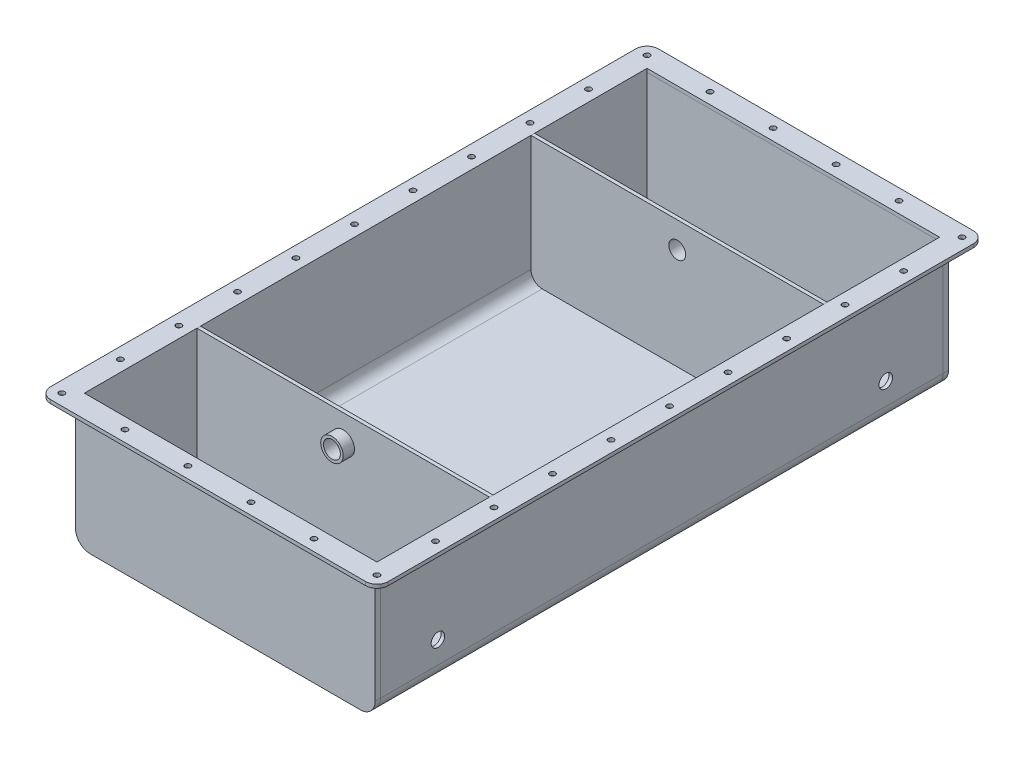
from build123d import *

# Parameters (mm, degrees)
INTERIOR_DIM_DEPTH      = 500
FILLET2_R               = 10
FILLET3_R               = 13.175
ENDCAP1_DEPTH           = 4.7625
COMPARTMENT1_BOSS_DEPTH = 3.175
SKETCH9_W               = 300
SKETCH9_H               = 540
SKETCH9_W_2             = 260
SKETCH9_H_2             = 500
LID_FLANGE_DEPTH        = 3.175
FILLET4_R               = 10
ENDCAP2_DEPTH           = 4.7625
COMPARTMENT2_BOSS_DEPTH = 3.175
SKETCH16_R              = 6
BEARING_HOLES_DEPTH     = 603.823905672
WIRE_PASSTHROUGH_START  = -300
SKETCH17_R              = 7.5
WIRE_PASSTHROUGH_DEPTH  = 300
SKETCH18_W              = 260
SKETCH18_H              = 3.175
BOSS_EXTRUDE1_DEPTH     = 3.18
SKETCH17_3_R            = 10
SKETCH17_3_R_2          = 7.5
WIRE_TUBE_2_DEPTH       = 10
WIRE_TUBE_1_START       = 10
SKETCH19_R              = 10
SKETCH19_R_2            = 7.5
WIRE_TUBE_1_DEPTH       = 10
SKETCH20_R              = 2.5
BOLT_HOLES_DEPTH        = 3.175


with BuildPart() as part:
    # Sketch2 → Interior Dim (new body)
    with BuildSketch(Plane.XY):
        Polygon((-130, 0), (130, 0), (130, 110), (133.175, 110), (133.175, -3.175), (-133.175, -3.175), (-133.175, 110), (-130, 110), align=None)
    extrude(amount=-INTERIOR_DIM_DEPTH)

    # Fillet2
    fillet2_edges = [part.edges().sort_by_distance(p)[0] for p in [
        (-130, 0, -250),
        (130, 0, -250),
    ]]
    fillet(fillet2_edges, radius=FILLET2_R)

    # Fillet3
    fillet3_edges = [part.edges().sort_by_distance(p)[0] for p in [
        (-133.175, -3.175, -250),
        (133.175, -3.175, -250),
    ]]
    fillet(fillet3_edges, radius=FILLET3_R)



with BuildPart() as body_2:
    # Sketch4 → Endcap1 (new body)
    with BuildSketch(Plane.XY):
        with BuildLine():
            Line((-130, 110), (130, 110))
            Line((130, 110), (133.175, 110))
            Line((133.175, 110), (133.175, 10))
            ThreePointArc((133.175, 10), (129.316131842, 0.683868158), (120, -3.175))
            Line((120, -3.175), (-120, -3.175))
            ThreePointArc((-120, -3.175), (-129.316131842, 0.683868158), (-133.175, 10))
            Line((-133.175, 10), (-133.175, 110))
            Line((-133.175, 110), (-130, 110))
        make_face()
    extrude(amount=ENDCAP1_DEPTH)


with BuildPart() as body_3:
    # Sketch7 → Compartment1_Boss (new body)
    with BuildSketch(Plane(origin=(0, 0, -100), x_dir=(-1, 0, 0), z_dir=(0, 0, -1))):
        with BuildLine():
            Line((120, 0), (-120, 0))
            ThreePointArc((-120, 0), (-127.071067812, 2.928932188), (-130, 10))
            Line((-130, 10), (-130, 110))
            Line((-130, 110), (130, 110))
            Line((130, 110), (130, 10))
            ThreePointArc((130, 10), (127.071067812, 2.928932188), (120, 0))
        make_face()
    extrude(amount=COMPARTMENT1_BOSS_DEPTH)


with BuildPart() as body_4:
    # Sketch9 → Lid_Flange (new body)
    with BuildSketch(Plane(origin=(0, 110, 0), x_dir=(1, 0, 0), z_dir=(0, 1, 0))):
        with Locations((0, 250)):
            Rectangle(SKETCH9_W, SKETCH9_H)
        with Locations((0, 250)):
            Rectangle(SKETCH9_W_2, SKETCH9_H_2, mode=Mode.SUBTRACT)
    extrude(amount=LID_FLANGE_DEPTH)

    # Fillet4
    fillet4_edges = [body_4.edges().sort_by_distance(p)[0] for p in [
        (150, 111.5875, -520),
        (150, 111.5875, 20),
        (-150, 111.5875, 20),
        (-150, 111.5875, -520),
    ]]
    fillet(fillet4_edges, radius=FILLET4_R)


with BuildPart() as body_5:
    # Sketch5 → Endcap2 (new body)
    with BuildSketch(Plane(origin=(0, 0, -500), x_dir=(-1, 0, 0), z_dir=(0, 0, -1))):
        with BuildLine():
            Line((133.175, 110), (-133.175, 110))
            Line((-133.175, 110), (-133.175, 10))
            ThreePointArc((-133.175, 10), (-129.316131842, 0.683868158), (-120, -3.175))
            Line((-120, -3.175), (120, -3.175))
            ThreePointArc((120, -3.175), (129.316131842, 0.683868158), (133.175, 10))
            Line((133.175, 10), (133.175, 110))
        make_face()
    extrude(amount=ENDCAP2_DEPTH)


with BuildPart() as part_1:
    add(part.part)

    add(body_4.part)  # Compartment2_Boss merges body 4
    # Sketch13 → Compartment2_Boss (add)
    with BuildSketch(Plane.XY.offset(-400)):
        with BuildLine():
            Line((130, 110), (-130, 110))
            Line((-130, 110), (-130, 10))
            ThreePointArc((-130, 10), (-127.071067812, 2.928932188), (-120, 0))
            Line((-120, 0), (120, 0))
            ThreePointArc((120, 0), (127.071067812, 2.928932188), (130, 10))
            Line((130, 10), (130, 110))
        make_face()
    extrude(amount=COMPARTMENT2_BOSS_DEPTH)

    # Sketch16 → Bearing_holes (cut, through all)
    with BuildSketch(Plane.ZY.offset(133.175)):
        with Locations(Location((-449, 29.5, 0), (0, 0, 270))):
            Circle(SKETCH16_R)
        with Locations(Location((-51, 29.5, 0), (0, 0, 270))):
            Circle(SKETCH16_R)
    extrude(amount=-BEARING_HOLES_DEPTH, mode=Mode.SUBTRACT)


with BuildPart() as wire_passthrough_tool:
    # Sketch17 → Wire_Passthrough (new body)
    with BuildSketch(Plane(origin=(0, 0, -400), x_dir=(-1, 0, 0), z_dir=(0, 0, -1)).offset(WIRE_PASSTHROUGH_START)):
        with Locations((0, 90)):
            Circle(SKETCH17_R)
    extrude(amount=WIRE_PASSTHROUGH_DEPTH)


with BuildPart() as part_2:
    add(part_1.part)

    # Wire_Passthrough: cut by wire_passthrough_tool
    add(wire_passthrough_tool.part, mode=Mode.SUBTRACT)



with BuildPart() as body_3_1:
    add(body_3.part)

    # Wire_Passthrough: cut by wire_passthrough_tool
    add(wire_passthrough_tool.part, mode=Mode.SUBTRACT)


with BuildPart() as part_3:
    add(part_2.part)

    add(body_3_1.part)  # Boss-Extrude1 merges body 3
    # Sketch18 → Boss-Extrude1 (add)
    with BuildSketch(Plane(origin=(0, 110, 0), x_dir=(1, 0, 0), z_dir=(0, 1, 0))):
        with Locations((0, 398.4125)):
            Rectangle(SKETCH18_W, SKETCH18_H)
        with Locations((0, 101.5875)):
            Rectangle(SKETCH18_W, SKETCH18_H)
    extrude(amount=BOSS_EXTRUDE1_DEPTH)

    # Sketch17<3> → Wire_Tube_2 (add)
    with BuildSketch(Plane(origin=(0, 0, -400), x_dir=(-1, 0, 0), z_dir=(0, 0, -1))):
        with Locations((0, 90)):
            Circle(SKETCH17_3_R)
        with Locations((0, 90)):
            Circle(SKETCH17_3_R_2, mode=Mode.SUBTRACT)
    extrude(amount=WIRE_TUBE_2_DEPTH)

    # Sketch19 → Wire_Tube_1 (add)
    with BuildSketch(Plane.XY.offset(-100).offset(WIRE_TUBE_1_START)):
        with Locations(Location((0, 90, 0), (0, 0, 180))):
            Circle(SKETCH19_R)
        with Locations(Location((0, 90, 0), (0, 0, 180))):
            Circle(SKETCH19_R_2, mode=Mode.SUBTRACT)
    extrude(amount=-WIRE_TUBE_1_DEPTH)

    # Sketch20 → Bolt_Holes (cut)
    with BuildSketch(Plane(origin=(0, 110, 175), x_dir=(1, 0, 0), z_dir=(0, 1, 0))):
        with Locations(Location((-140, 165, 0), (0, 0, 270))):
            Circle(SKETCH20_R)
        with Locations(Location((-140, 217, 0), (0, 0, 270))):
            Circle(SKETCH20_R)
        with Locations(Location((-140, 269, 0), (0, 0, 270))):
            Circle(SKETCH20_R)
        with Locations(Location((-140, 321, 0), (0, 0, 270))):
            Circle(SKETCH20_R)
        with Locations(Location((-140, 373, 0), (0, 0, 270))):
            Circle(SKETCH20_R)
        with Locations(Location((-140, 425, 0), (0, 0, 270))):
            Circle(SKETCH20_R)
        with Locations(Location((-140, 477, 0), (0, 0, 270))):
            Circle(SKETCH20_R)
        with Locations(Location((-140, 529, 0), (0, 0, 270))):
            Circle(SKETCH20_R)
        with Locations(Location((-140, 581, 0), (0, 0, 270))):
            Circle(SKETCH20_R)
        with Locations(Location((-140, 633, 0), (0, 0, 270))):
            Circle(SKETCH20_R)
        with Locations(Location((-140, 685, 0), (0, 0, 270))):
            Circle(SKETCH20_R)
        with Locations(Location((-84, 685, 0), (0, 0, 270))):
            Circle(SKETCH20_R)
        with Locations(Location((-28, 685, 0), (0, 0, 270))):
            Circle(SKETCH20_R)
        with Locations(Location((28, 685, 0), (0, 0, 270))):
            Circle(SKETCH20_R)
        with Locations(Location((84, 685, 0), (0, 0, 270))):
            Circle(SKETCH20_R)
        with Locations(Location((140, 685, 0), (0, 0, 270))):
            Circle(SKETCH20_R)
        with Locations(Location((140, 633, 0), (0, 0, 270))):
            Circle(SKETCH20_R)
        with Locations(Location((140, 581, 0), (0, 0, 270))):
            Circle(SKETCH20_R)
        with Locations(Location((140, 529, 0), (0, 0, 270))):
            Circle(SKETCH20_R)
        with Locations(Location((140, 477, 0), (0, 0, 270))):
            Circle(SKETCH20_R)
        with Locations(Location((140, 425, 0), (0, 0, 270))):
            Circle(SKETCH20_R)
        with Locations(Location((140, 373, 0), (0, 0, 270))):
            Circle(SKETCH20_R)
        with Locations(Location((140, 321, 0), (0, 0, 270))):
            Circle(SKETCH20_R)
        with Locations(Location((140, 269, 0), (0, 0, 270))):
            Circle(SKETCH20_R)
        with Locations(Location((140, 217, 0), (0, 0, 270))):
            Circle(SKETCH20_R)
        with Locations(Location((140, 165, 0), (0, 0, 270))):
            Circle(SKETCH20_R)
        with Locations(Location((84, 165, 0), (0, 0, 270))):
            Circle(SKETCH20_R)
        with Locations(Location((28, 165, 0), (0, 0, 270))):
            Circle(SKETCH20_R)
        with Locations(Location((-28, 165, 0), (0, 0, 270))):
            Circle(SKETCH20_R)
        with Locations(Location((-84, 165, 0), (0, 0, 270))):
            Circle(SKETCH20_R)
    extrude(amount=BOLT_HOLES_DEPTH, mode=Mode.SUBTRACT)


solid = Compound([body_2.part, body_5.part, part_3.part])
